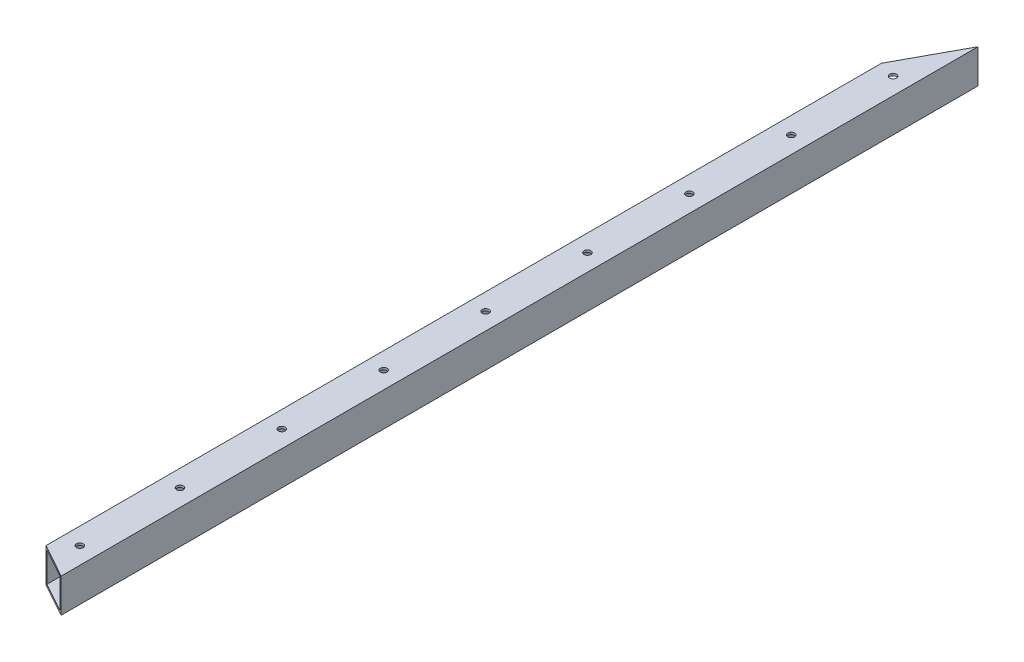
from build123d import *

# Parameters (mm, degrees)
SKETCH1_W           = 25.4
SKETCH1_H           = 25.4
SKETCH1_W_2         = 22.225
SKETCH1_H_2         = 22.225
BOSS_EXTRUDE1_DEPTH = 685.8
SKETCH3_R           = 2.54
CUT_EXTRUDE2_DEPTH  = 687.740096397


with BuildPart() as part:
    # Sketch1 → Boss-Extrude1 (new body)
    with BuildSketch(Plane.XY):
        with Locations((12.7, 12.7)):
            Rectangle(SKETCH1_W, SKETCH1_H)
        with Locations((12.7, 12.7)):
            Rectangle(SKETCH1_W_2, SKETCH1_H_2, mode=Mode.SUBTRACT)
    extrude(amount=BOSS_EXTRUDE1_DEPTH)

    # Sketch3 → Cut-Extrude2 (cut, through all)
    with BuildSketch(Plane(origin=(0, 25.4, 0), x_dir=(1, 0, 0), z_dir=(0, 1, 0))):
        with Locations(Location((12.7, -50.8, 0), (0, 0, 270))):
            Circle(SKETCH3_R)
        with Locations(Location((12.7, -127, 0), (0, 0, 270))):
            Circle(SKETCH3_R)
        with Locations(Location((12.7, -203.2, 0), (0, 0, 270))):
            Circle(SKETCH3_R)
        with Locations(Location((12.7, -279.4, 0), (0, 0, 270))):
            Circle(SKETCH3_R)
        with Locations(Location((12.7, -355.6, 0), (0, 0, 270))):
            Circle(SKETCH3_R)
        with Locations(Location((12.7, -431.8, 0), (0, 0, 270))):
            Circle(SKETCH3_R)
        with Locations(Location((12.7, -508, 0), (0, 0, 270))):
            Circle(SKETCH3_R)
        with Locations(Location((12.7, -584.2, 0), (0, 0, 270))):
            Circle(SKETCH3_R)
        with Locations(Location((12.7, -659.13, 0), (0, 0, 270))):
            Circle(SKETCH3_R)
        Polygon((0, 0), (0, -46.780980505), (25.4, 0), align=None)
        Polygon((0, -685.8), (0, -671.720550093), (25.4, -685.8), align=None)
    extrude(amount=-CUT_EXTRUDE2_DEPTH, mode=Mode.SUBTRACT)


solid = part.part
